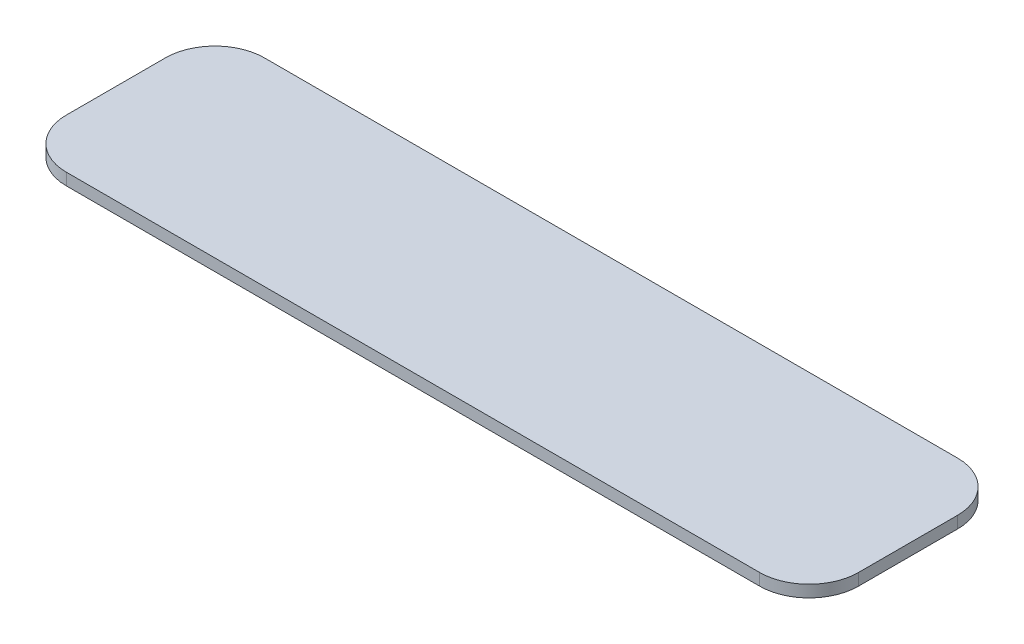
from build123d import *

# Parameters (mm, degrees)
SKETCH1_W           = 160
SKETCH1_H           = 40
BOSS_EXTRUDE1_DEPTH = 1.2
FILLET1_R           = 10
SKETCH2_W           = 2.692307692
SKETCH2_H           = 30
CUT_EXTRUDE1_DEPTH  = 0.1


with BuildPart() as part:
    # Sketch1 → Boss-Extrude1 (new, symmetric)
    with BuildSketch(Plane(origin=(0, 0, 0), x_dir=(1, 0, 0), z_dir=(0, 1, 0))):
        Rectangle(SKETCH1_W, SKETCH1_H)
    extrude(amount=BOSS_EXTRUDE1_DEPTH, both=True)

    # Fillet1
    fillet1_edges = [part.edges().sort_by_distance(p)[0] for p in [
        (-80, 0, -20),
        (80, 0, -20),
        (80, 0, 20),
        (-80, 0, 20),
    ]]
    fillet(fillet1_edges, radius=FILLET1_R)

    # Sketch2 → Cut-Extrude1 (cut, symmetric)
    with BuildSketch(Plane(origin=(0, 0, 0), x_dir=(1, 0, 0), z_dir=(0, 1, 0))):
        Polygon((-72.5, 12.819526529), (-72.5, 15.896449606), (-56.730769231, 15.896449606), (-56.730769231, 12.819526529), (-63.269230769, 12.819526529), (-63.269230769, -14.103550394), (-65.961538462, -14.103550394), (-65.961538462, 12.819526529), align=None)
        with Locations((-45.692307692, 0.896449606)):
            Rectangle(SKETCH2_W, SKETCH2_H)
        Polygon((-31.576923077, -14.103550394), (-31.576923077, 15.896449606), (-31.012019231, 15.896449606), (-11.192307692, -7.71532924), (-11.192307692, 15.896449606), (-8.5, 15.896449606), (-8.5, -14.103550394), (-9.112980769, -14.103550394), (-28.884615385, 9.454141914), (-28.884615385, -14.103550394), align=None)
        with BuildLine():
            Line((1.192307692, -8.316290778), (3.728365385, -6.795858086))
            add(Edge.make_bspline(
                [(3.728365385, -6.795858086), (3.96423599, -7.190695671), (4.416154966, -7.947189248), (5.170023759, -8.969401023), (5.951162998, -9.838219509), (6.765357285, -10.548590431), (7.607636841, -11.107866603), (8.483500158, -11.503885732), (9.389995679, -11.750879807), (10.006914149, -11.780880549), (10.314903846, -11.795858086)],
                knots=[0, 0, 0, 0, 1.272034388, 2.437168799, 3.508375237, 4.49857839, 5.41946034, 6.295179144, 7.148887113, 8, 8, 8, 8], degree=3))
            add(Edge.make_bspline(
                [(10.314903846, -11.795858086), (10.577934079, -11.788532322), (11.099392134, -11.774008977), (11.867068502, -11.634459245), (12.612626807, -11.420069568), (13.320700845, -11.113033012), (13.981520398, -10.741560278), (14.561006358, -10.292878756), (15.061973042, -9.79053985), (15.471765453, -9.230117096), (15.786165755, -8.627398679), (16.027812056, -8.008747668), (16.161912687, -7.364445654), (16.182113431, -6.930641687), (16.192307692, -6.711723471)],
                knots=[0, 0, 0, 0, 1.095163259, 2.171163733, 3.241058638, 4.321873601, 5.38011039, 6.391990106, 7.366004449, 8.327778327, 9.272591725, 10.192022065, 11.087607919, 12, 12, 12, 12], degree=3))
            add(Edge.make_bspline(
                [(16.192307692, -6.711723471), (16.179670743, -6.461944759), (16.153981673, -5.954181138), (15.936854701, -5.205041255), (15.595289728, -4.463676369), (15.280181353, -4.005094093), (15.116586538, -3.767011932)],
                knots=[0, 0, 0, 0, 0.938893495, 1.908633276, 2.914225137, 4, 4, 4, 4], degree=3))
            add(Edge.make_bspline(
                [(15.116586538, -3.767011932), (14.982266988, -3.595182016), (14.700279894, -3.234446599), (14.215501215, -2.697487438), (13.646648807, -2.143615276), (13.013189765, -1.551680502), (12.292049003, -0.949213673), (11.505813165, -0.307485576), (10.63440866, 0.34909937), (10.023270118, 0.789435646), (9.707932692, 1.016641914)],
                knots=[0, 0, 0, 0, 0.722233717, 1.516239348, 2.393582979, 3.351407094, 4.387010283, 5.505090956, 6.712668013, 8, 8, 8, 8], degree=3))
            add(Edge.make_bspline(
                [(9.707932692, 1.016641914), (9.392298439, 1.241458379), (8.788829783, 1.671290341), (7.944899077, 2.309212776), (7.190232251, 2.892445943), (6.528183538, 3.426480333), (5.959044137, 3.911388373), (5.478329185, 4.342513566), (5.09828441, 4.731515516), (4.886950862, 4.983869874), (4.792067308, 5.09717076)],
                knots=[0, 0, 0, 0, 1.452282411, 2.77665338, 3.964542531, 5.026858415, 5.96415736, 6.766646006, 7.446254459, 8, 8, 8, 8], degree=3))
            add(Edge.make_bspline(
                [(4.792067308, 5.09717076), (4.659445491, 5.273751076), (4.398626891, 5.621019965), (4.054346844, 6.163804461), (3.761725449, 6.71943245), (3.53233403, 7.289397003), (3.33916644, 7.865696394), (3.20924132, 8.455849928), (3.127886489, 9.057209515), (3.119555176, 9.461896663), (3.115384615, 9.664478452)],
                knots=[0, 0, 0, 0, 1.068054152, 2.10047183, 3.106115577, 4.101338837, 5.06977816, 6.043150881, 7.020423561, 8, 8, 8, 8], degree=3))
            add(Edge.make_bspline(
                [(3.115384615, 9.664478452), (3.126572121, 9.98187652), (3.148708007, 10.609888495), (3.335912441, 11.527295613), (3.631394387, 12.403179189), (4.045350568, 13.228867764), (4.578985022, 13.982861886), (5.196521945, 14.673834631), (5.93204897, 15.254708193), (6.739071455, 15.762240122), (7.622411787, 16.15949091), (8.548048102, 16.459156454), (9.517451577, 16.628950092), (10.174049873, 16.653316648), (10.507211538, 16.665680376)],
                knots=[0, 0, 0, 0, 1.005424448, 1.989358655, 2.955360095, 3.929531133, 4.905563448, 5.876582895, 6.856512386, 7.866279853, 8.892233794, 9.918561126, 10.94386622, 12, 12, 12, 12], degree=3))
            add(Edge.make_bspline(
                [(10.507211538, 16.665680376), (10.860732398, 16.653487076), (11.563772556, 16.629238495), (12.597908689, 16.418402513), (13.593571973, 16.069539611), (14.394514243, 15.673636829), (15.021366484, 15.278224694), (15.499418478, 14.918054772), (15.983853771, 14.503410984), (16.478579955, 14.033188874), (16.975214179, 13.503073865), (17.481129484, 12.916696532), (17.997508931, 12.277640338), (18.329702017, 11.821430332), (18.5, 11.587555376)],
                knots=[0, 0, 0, 0, 1.286793592, 2.559021753, 3.825965368, 5.121522368, 5.803751409, 6.523245864, 7.299691795, 8.125521123, 9.008227632, 9.944561021, 10.946284179, 12, 12, 12, 12], degree=3))
            Line((18.5, 11.587555376), (16.066105769, 9.742603452))
            add(Edge.make_bspline(
                [(16.066105769, 9.742603452), (15.919140634, 9.931935085), (15.636120145, 10.296543541), (15.206438829, 10.807154817), (14.801450418, 11.273581785), (14.402446991, 11.678711454), (14.030501579, 12.044729739), (13.669498359, 12.358099084), (13.324632492, 12.621889902), (12.889916115, 12.90340613), (12.343764243, 13.182461875), (11.658182504, 13.41859683), (10.941728718, 13.56049736), (10.453760448, 13.579259254), (10.206730769, 13.588757299)],
                knots=[0, 0, 0, 0, 1.181633172, 2.275549214, 3.290209073, 4.226197932, 5.078386478, 5.862611352, 6.581680152, 7.217281963, 8.414376989, 9.595101626, 10.782541182, 12, 12, 12, 12], degree=3))
            add(Edge.make_bspline(
                [(10.206730769, 13.588757299), (9.89681772, 13.578371299), (9.299179599, 13.558342877), (8.450691861, 13.339600146), (7.687029646, 12.995184201), (7.030864803, 12.512484388), (6.484547857, 11.940590165), (6.08935821, 11.282485693), (5.851499657, 10.555779385), (5.822474403, 10.048850902), (5.807692308, 9.790680376)],
                knots=[0, 0, 0, 0, 1.14458467, 2.207223713, 3.21896685, 4.227309161, 5.202851033, 6.127160689, 7.046193047, 8, 8, 8, 8], degree=3))
            add(Edge.make_bspline(
                [(5.807692308, 9.790680376), (5.811061965, 9.629953417), (5.817806788, 9.308236679), (5.911876483, 8.832938776), (6.032727874, 8.358841581), (6.224236146, 7.888076585), (6.488624463, 7.412410651), (6.835811685, 6.9236529), (7.273068645, 6.417495397), (7.608014465, 6.088289336), (7.784855769, 5.914478452)],
                knots=[0, 0, 0, 0, 0.858281714, 1.717966888, 2.583508476, 3.4729293, 4.427298488, 5.488583878, 6.674047936, 8, 8, 8, 8], degree=3))
            add(Edge.make_bspline(
                [(7.784855769, 5.914478452), (7.850524676, 5.855875374), (8.006538965, 5.716647874), (8.291761186, 5.48871404), (8.668413742, 5.20754742), (9.126661181, 4.859656136), (9.674952853, 4.456100747), (10.313349048, 4.002041214), (11.034733615, 3.482737279), (11.546635752, 3.119672646), (11.817307692, 2.927699606)],
                knots=[0, 0, 0, 0, 0.420754252, 0.999615792, 1.744751191, 2.668019286, 3.750313428, 4.999500688, 6.413464383, 8, 8, 8, 8], degree=3))
            add(Edge.make_bspline(
                [(11.817307692, 2.927699606), (12.142901235, 2.690773667), (12.773368004, 2.231999424), (13.670432975, 1.542722166), (14.483808473, 0.868598436), (15.216350217, 0.213933232), (15.875295147, -0.416307565), (16.453332753, -1.029706254), (16.95635287, -1.621868305), (17.497889028, -2.381061811), (18.051241767, -3.313471105), (18.526454688, -4.455856007), (18.826097666, -5.602681611), (18.865282084, -6.373483067), (18.884615385, -6.753790778)],
                knots=[0, 0, 0, 0, 1.163667725, 2.253281268, 3.268753668, 4.215851969, 5.092017293, 5.902905408, 6.650798638, 7.335211899, 8.59617414, 9.77448103, 10.901945474, 12, 12, 12, 12], degree=3))
            add(Edge.make_bspline(
                [(18.884615385, -6.753790778), (18.878982772, -7.022748193), (18.867826929, -7.555440052), (18.739590525, -8.337626426), (18.551707681, -9.097319594), (18.26853139, -9.82512913), (17.922904319, -10.534369953), (17.48433648, -11.20643767), (16.975984896, -11.856206801), (16.39283834, -12.466351013), (15.754730606, -13.026461264), (15.080298937, -13.524710362), (14.368439455, -13.940153134), (13.623013884, -14.279160352), (12.843850998, -14.544304788), (12.03121285, -14.736415095), (11.183759897, -14.854321188), (10.607755769, -14.866559144), (10.314903846, -14.872781163)],
                knots=[0, 0, 0, 0, 0.983748083, 1.948392443, 2.894712957, 3.844097841, 4.80183111, 5.778335162, 6.776009319, 7.81870978, 8.863265674, 9.881300176, 10.883814829, 11.87499822, 12.874611388, 13.892143829, 14.928324115, 16, 16, 16, 16], degree=3))
            add(Edge.make_bspline(
                [(10.314903846, -14.872781163), (10.088315192, -14.868399606), (9.637991534, -14.859691674), (8.971910261, -14.782709271), (8.319285211, -14.67379124), (7.688305651, -14.50087064), (7.070842122, -14.29106798), (6.469580112, -14.032739415), (5.884228222, -13.723163402), (5.311506083, -13.369206048), (4.752870301, -12.957282524), (4.213560576, -12.477509697), (3.675881843, -11.943119654), (3.15570416, -11.33960054), (2.64250578, -10.676702687), (2.146405127, -9.948223972), (1.657133261, -9.158132368), (1.350143537, -8.602145919), (1.192307692, -8.316290778)],
                knots=[0, 0, 0, 0, 0.915332311, 1.819136955, 2.706846663, 3.586547465, 4.459518054, 5.340707479, 6.227863349, 7.133153174, 8.059268498, 9.028702269, 10.047606654, 11.120612155, 12.245963614, 13.433783089, 14.680604001, 16, 16, 16, 16], degree=3))
        make_face()
        Polygon((30.115384615, 15.896449606), (47.038461538, 15.896449606), (47.038461538, 12.819526529), (32.807692308, 12.819526529), (32.807692308, 3.588757299), (47.038461538, 3.588757299), (47.038461538, 0.511834222), (32.807692308, 0.511834222), (32.807692308, -11.026627317), (47.038461538, -11.026627317), (47.038461538, -14.103550394), (30.115384615, -14.103550394), align=None)
        Polygon((57.5, 15.896449606), (60.192307692, 15.896449606), (60.192307692, -11.026627317), (71.730769231, -11.026627317), (71.730769231, -14.103550394), (57.5, -14.103550394), align=None)
    extrude(amount=CUT_EXTRUDE1_DEPTH, both=True, mode=Mode.SUBTRACT)


solid = part.part
